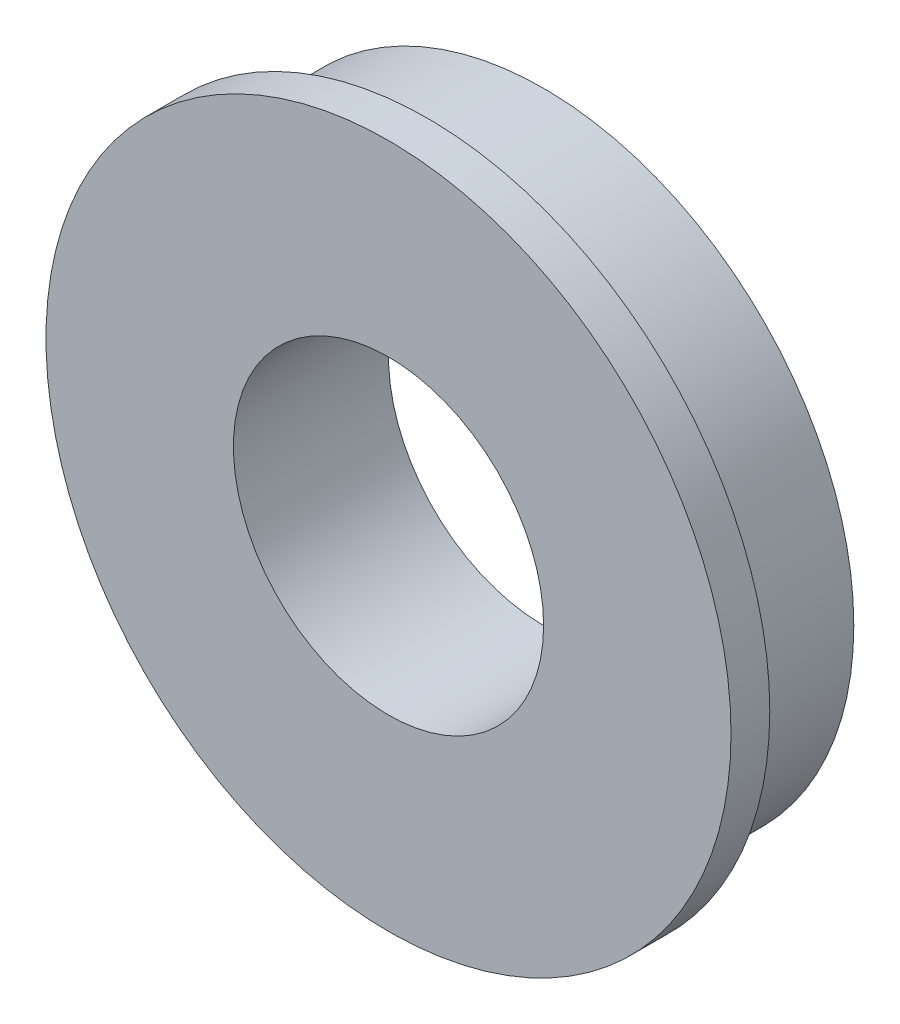
from build123d import *

# Parameters (mm, degrees)
SKETCH_1_R          = 12
EXTRUDE_1_DEPTH     = 4.5
SKETCH_2_R          = 13.25
EXTRUDE_2_DEPTH     = 1.5
SKETCH_3_R          = 6
CUT_EXTRUDE_1_DEPTH = 39.132990966


with BuildPart() as part:
    # ｽｹｯﾁ1 → 押し出し1 (new body)
    with BuildSketch(Plane.XY):
        with Locations((-22, 0)):
            Circle(SKETCH_1_R)
    extrude(amount=-EXTRUDE_1_DEPTH)

    # ｽｹｯﾁ2 → 押し出し2 (add)
    with BuildSketch(Plane.XY):
        with Locations((-22, 0)):
            Circle(SKETCH_2_R)
    extrude(amount=EXTRUDE_2_DEPTH)

    # ｽｹｯﾁ3 → ｶｯﾄ - 押し出し1 (cut, through all)
    with BuildSketch(Plane.XY.offset(1.5)):
        with Locations((-22, 0)):
            Circle(SKETCH_3_R)
    extrude(amount=-CUT_EXTRUDE_1_DEPTH, mode=Mode.SUBTRACT)


solid = part.part
